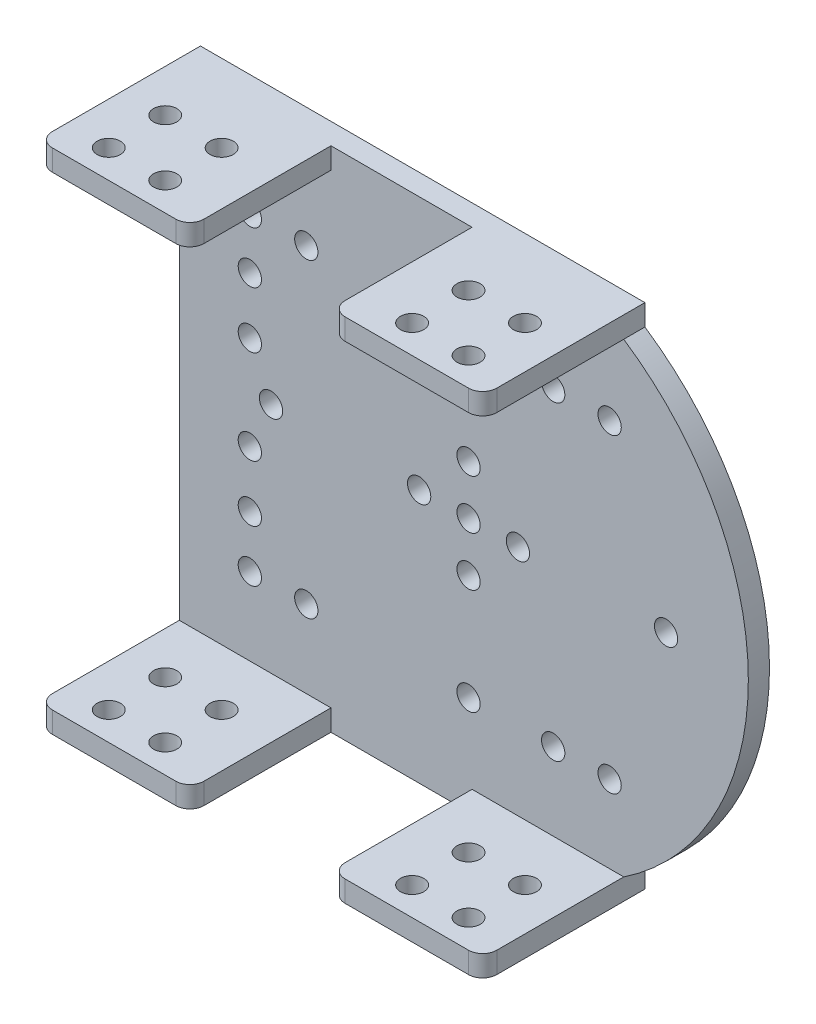
from build123d import *

# Parameters (mm, degrees)
SKETCH_4_R          = 1.65
EXTRUDE_1_DEPTH     = 3
SKETCH_5_W          = 63
SKETCH_5_H          = 3
EXTRUDE_2_DEPTH     = 20
SKETCH_6_R          = 1.65
SKETCH_6_W          = 10
SKETCH_6_H          = 20
CUT_EXTRUDE_1_DEPTH = 100
FILLET_2_R          = 2


with BuildPart() as part:
    # 草图4 → 凸台-拉伸1 (new body)
    with BuildSketch(Plane.XY):
        with BuildLine():
            Line((75, 69), (75, 72))
            Line((75, 72), (12, 72))
            Line((12, 72), (12, 36))
            Line((12, 36), (12, 0))
            Line((12, 0), (75, 0))
            Line((75, 0), (75, 3))
            ThreePointArc((75, 3), (92.66106403, 36), (75, 69))
        make_face()
        with Locations((22, 14)):
            Circle(SKETCH_4_R, mode=Mode.SUBTRACT)
        with Locations((30, 14)):
            Circle(SKETCH_4_R, mode=Mode.SUBTRACT)
        with Locations((22, 21.35)):
            Circle(SKETCH_4_R, mode=Mode.SUBTRACT)
        with Locations((22, 29.35)):
            Circle(SKETCH_4_R, mode=Mode.SUBTRACT)
        with Locations((53, 14)):
            Circle(SKETCH_4_R, mode=Mode.SUBTRACT)
        with Locations((65, 14)):
            Circle(SKETCH_4_R, mode=Mode.SUBTRACT)
        with Locations((73, 14)):
            Circle(SKETCH_4_R, mode=Mode.SUBTRACT)
        with BuildLine():
            ThreePointArc((26.65, 36), (25, 34.35), (23.35, 36))
            ThreePointArc((23.35, 36), (25, 37.65), (26.65, 36))
        make_face(mode=Mode.SUBTRACT)
        with Locations((22, 42.65)):
            Circle(SKETCH_4_R, mode=Mode.SUBTRACT)
        with Locations((22, 50.65)):
            Circle(SKETCH_4_R, mode=Mode.SUBTRACT)
        with Locations((22, 58)):
            Circle(SKETCH_4_R, mode=Mode.SUBTRACT)
        with Locations((30, 58)):
            Circle(SKETCH_4_R, mode=Mode.SUBTRACT)
        with Locations((81, 36)):
            Circle(SKETCH_4_R, mode=Mode.SUBTRACT)
        with Locations((53, 58)):
            Circle(SKETCH_4_R, mode=Mode.SUBTRACT)
        with Locations((65, 58)):
            Circle(SKETCH_4_R, mode=Mode.SUBTRACT)
        with Locations((73, 58)):
            Circle(SKETCH_4_R, mode=Mode.SUBTRACT)
        with Locations((53, 43)):
            Circle(SKETCH_4_R, mode=Mode.SUBTRACT)
        with Locations((53, 29)):
            Circle(SKETCH_4_R, mode=Mode.SUBTRACT)
        with Locations((46, 36)):
            Circle(SKETCH_4_R, mode=Mode.SUBTRACT)
        with Locations((53, 36)):
            Circle(SKETCH_4_R, mode=Mode.SUBTRACT)
        with Locations((60, 36)):
            Circle(SKETCH_4_R, mode=Mode.SUBTRACT)
    extrude(amount=EXTRUDE_1_DEPTH)

    # 草图5 → 凸台-拉伸2 (add)
    with BuildSketch(Plane.XY.offset(3)):
        with Locations((43.5, 70.5)):
            Rectangle(SKETCH_5_W, SKETCH_5_H)
        with Locations((43.5, 1.5)):
            Rectangle(SKETCH_5_W, SKETCH_5_H)
    extrude(amount=EXTRUDE_2_DEPTH)

    # 草图6 → 切除-拉伸1 (cut)
    with BuildSketch(Plane(origin=(0, 72, 0), x_dir=(1, 0, 0), z_dir=(0, 1, 0))):
        with Locations(Location((18, -11, 0), (0, 0, 270))):
            Circle(SKETCH_6_R)
        with Locations(Location((18, -19, 0), (0, 0, 270))):
            Circle(SKETCH_6_R)
        with Locations(Location((26, -19, 0), (0, 0, 270))):
            Circle(SKETCH_6_R)
        with Locations(Location((26, -11, 0), (0, 0, 270))):
            Circle(SKETCH_6_R)
        with Locations(Location((61, -11, 0), (0, 0, 270))):
            Circle(SKETCH_6_R)
        with Locations(Location((61, -19, 0), (0, 0, 270))):
            Circle(SKETCH_6_R)
        with Locations(Location((69, -19, 0), (0, 0, 270))):
            Circle(SKETCH_6_R)
        with Locations(Location((69, -11, 0), (0, 0, 270))):
            Circle(SKETCH_6_R)
        with Locations((38.5, -13)):
            Rectangle(SKETCH_6_W, SKETCH_6_H)
        with Locations((48.5, -13)):
            Rectangle(SKETCH_6_W, SKETCH_6_H)
    extrude(amount=-CUT_EXTRUDE_1_DEPTH, mode=Mode.SUBTRACT)

    # 圆角2
    fillet_2_edges = [part.edges().sort_by_distance(p)[0] for p in [
        (12, 70.5, 23),
        (75, 70.5, 23),
        (12, 1.5, 23),
        (75, 1.5, 23),
        (33.5, 1.5, 23),
        (53.5, 1.5, 23),
        (53.5, 70.5, 23),
        (33.5, 70.5, 23),
    ]]
    fillet(fillet_2_edges, radius=FILLET_2_R)


solid = part.part
